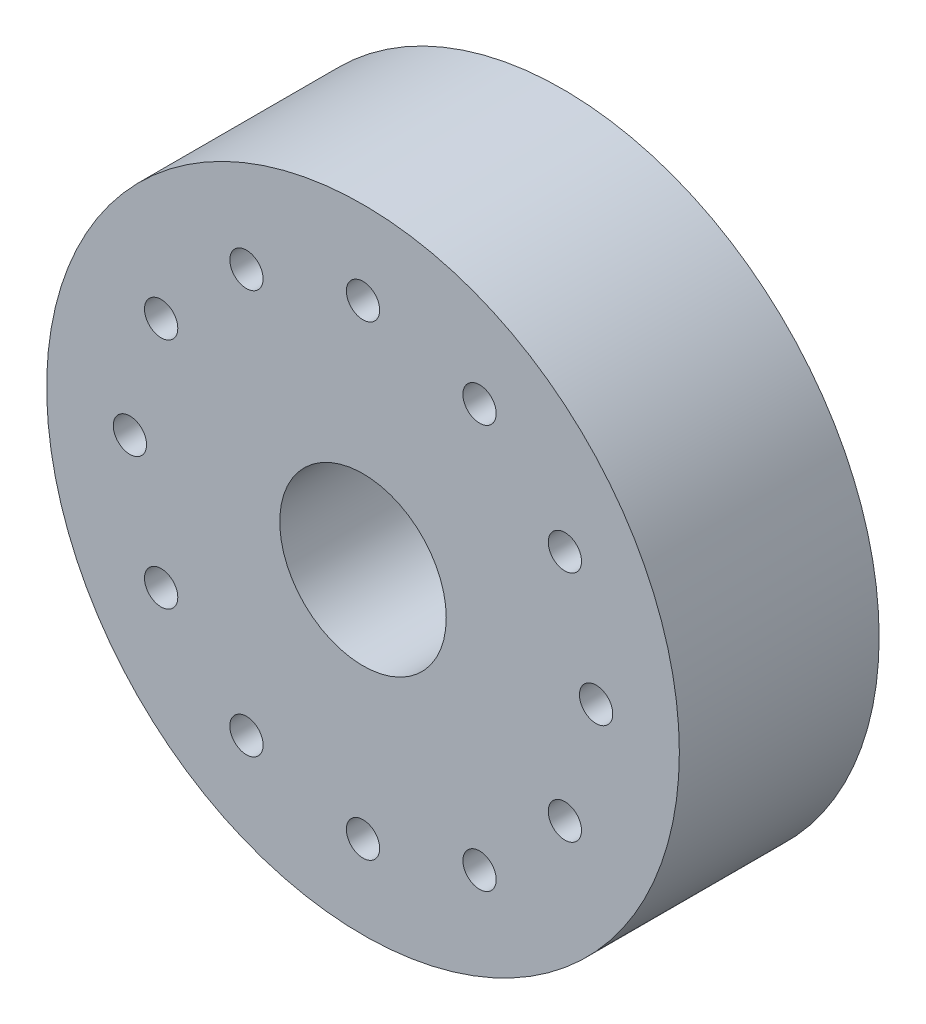
from build123d import *

# Parameters (mm, degrees)
ESQUISSE1_R        = 9.5
ESQUISSE1_R_2      = 2.5
ESQUISSE1_R_3      = 0.5
BOSS_EXTRU_1_DEPTH = 6


with BuildPart() as part:
    # Esquisse1 → Boss.-Extru.1 (new body)
    with BuildSketch(Plane.XY):
        Circle(ESQUISSE1_R)
        Circle(ESQUISSE1_R_2, mode=Mode.SUBTRACT)
        with Locations((0, 7)):
            Circle(ESQUISSE1_R_3, mode=Mode.SUBTRACT)
        with Locations((3.5, 6.062177826)):
            Circle(ESQUISSE1_R_3, mode=Mode.SUBTRACT)
        with Locations((6.062177826, 3.5)):
            Circle(ESQUISSE1_R_3, mode=Mode.SUBTRACT)
        with Locations((7, 0)):
            Circle(ESQUISSE1_R_3, mode=Mode.SUBTRACT)
        with Locations((6.062177826, -3.5)):
            Circle(ESQUISSE1_R_3, mode=Mode.SUBTRACT)
        with Locations((3.5, -6.062177826)):
            Circle(ESQUISSE1_R_3, mode=Mode.SUBTRACT)
        with Locations((0, -7)):
            Circle(ESQUISSE1_R_3, mode=Mode.SUBTRACT)
        with Locations((-3.5, -6.062177826)):
            Circle(ESQUISSE1_R_3, mode=Mode.SUBTRACT)
        with Locations((-6.062177826, -3.5)):
            Circle(ESQUISSE1_R_3, mode=Mode.SUBTRACT)
        with Locations((-7, 0)):
            Circle(ESQUISSE1_R_3, mode=Mode.SUBTRACT)
        with Locations((-6.062177826, 3.5)):
            Circle(ESQUISSE1_R_3, mode=Mode.SUBTRACT)
        with Locations((-3.5, 6.062177826)):
            Circle(ESQUISSE1_R_3, mode=Mode.SUBTRACT)
    extrude(amount=BOSS_EXTRU_1_DEPTH)


solid = part.part
